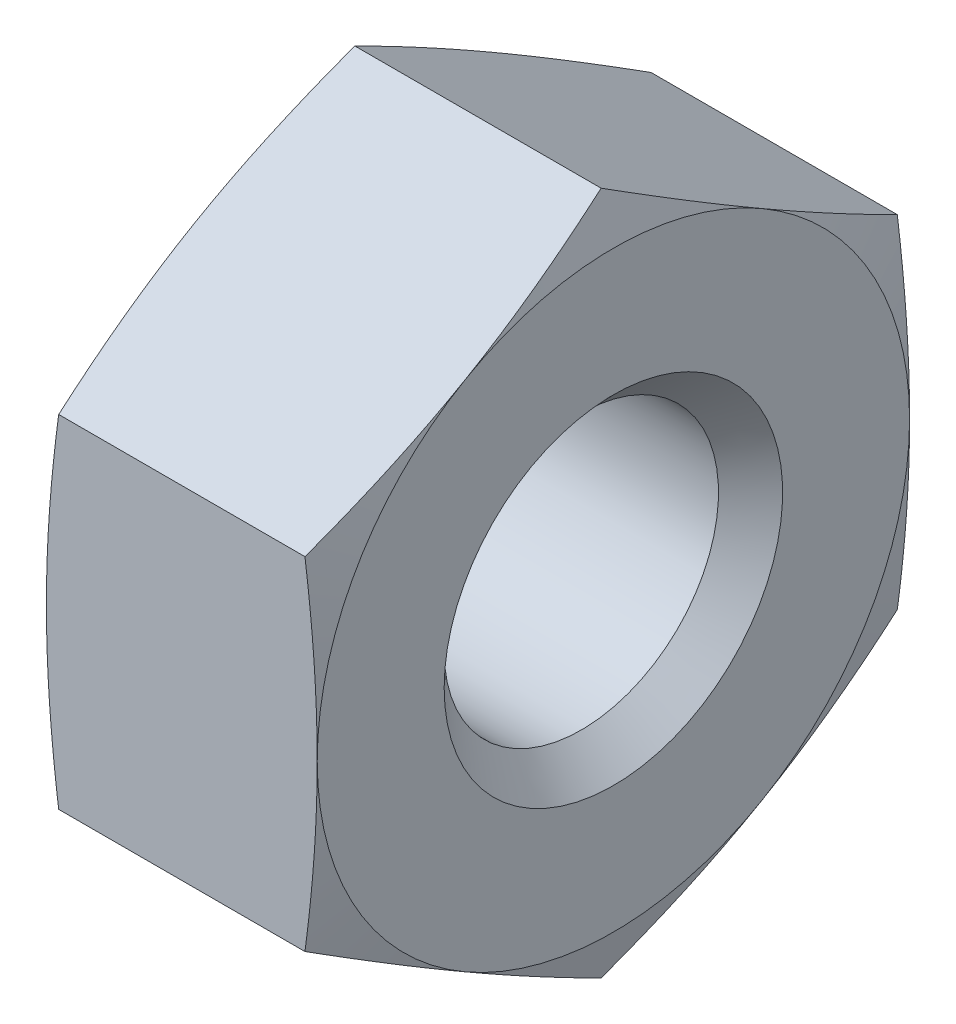
from build123d import *

# Parameters (mm, degrees)
CUT_EXTRUDE_1_DEPTH      = 3.2
CUT_EXTRUDE_1_DEPTH_BACK = 3.2
SKETCH_3_W               = 14
SKETCH_3_H               = 14


with BuildPart() as part:
    # 草圖1 → 旋轉1 (revolve)
    with BuildSketch(Plane.XY):
        Polygon((-1.6, 0), (-1.6, 3.5), (-1.412435565, 4.2), (1.412435565, 4.2), (1.6, 3.5), (1.6, 0), align=None)
    revolve(axis=Axis((1.6, 0, 0), (-1, 0, 0)))

    # 草圖2 → 除料-旋轉1 (revolve, cut)
    with BuildSketch(Plane.XY):
        Polygon((-1.6, 0), (-1.6, 2), (-1.221, 1.621), (1.221, 1.621), (1.6, 2), (1.6, 0), align=None)
    revolve(axis=Axis((1.6, 0, 0), (-1, 0, 0)), mode=Mode.SUBTRACT)

    # 草圖3 → 除料-伸長1 (cut, two sides: drawn at the far end of the back side and taken through both)
    with BuildSketch(Plane(origin=(0, 0, 0), x_dir=(0, 0, -1), z_dir=(1, 0, 0)).offset(-CUT_EXTRUDE_1_DEPTH_BACK)):
        Rectangle(SKETCH_3_W, SKETCH_3_H)
        Polygon((-3.5, 2.020725942), (-3.5, -2.020725942), (0, -4.041451884), (3.5, -2.020725942), (3.5, 2.020725942), (0, 4.041451884), align=None, mode=Mode.SUBTRACT)
    extrude(amount=CUT_EXTRUDE_1_DEPTH + CUT_EXTRUDE_1_DEPTH_BACK, mode=Mode.SUBTRACT)


solid = part.part
